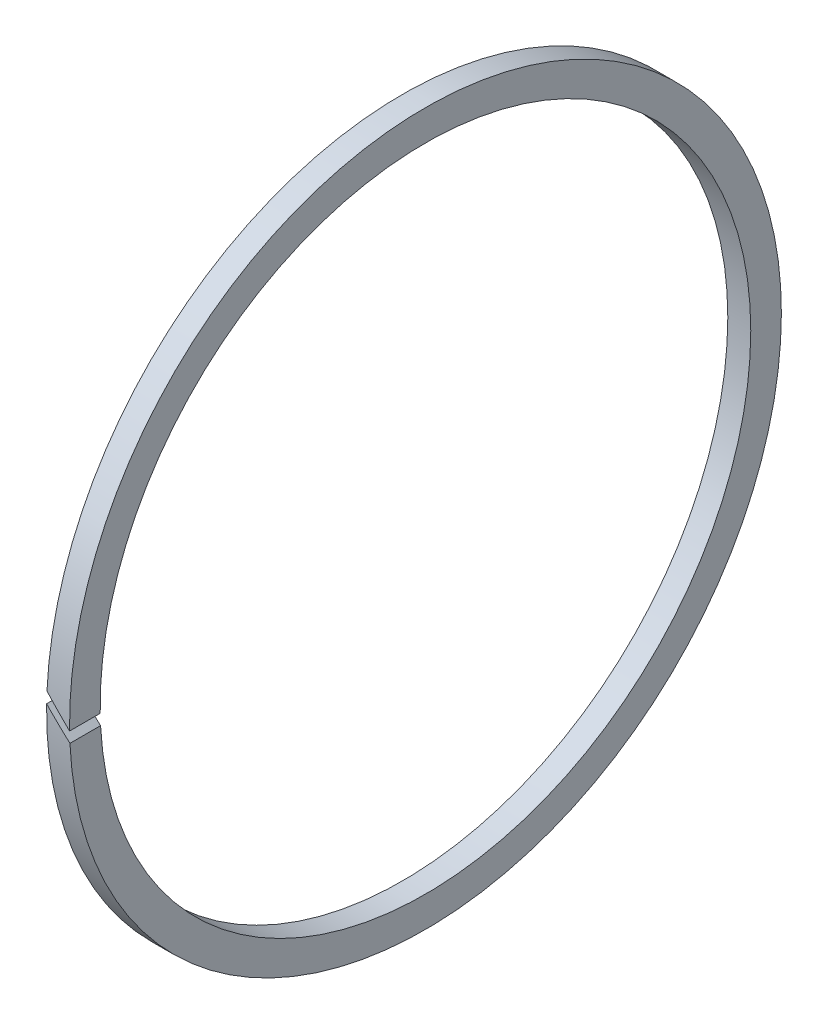
from build123d import *

# Parameters (mm, degrees)
SKETCH1_W               = 3
SKETCH1_H               = 4
CUT_EXTRUDE2_REACH      = 67.829
CUT_EXTRUDE2_END_RADIUS = 46.5


with BuildPart() as part:
    # Sketch1 → Revolve1 (revolve)
    with BuildSketch(Plane.XY, mode=Mode.PRIVATE) as revolve1_sk:
        with Locations((1.5, 44.5)):
            Rectangle(SKETCH1_W, SKETCH1_H)
    revolve(revolve1_sk.sketch.rotate(Axis((0, 0, 0), (1, 0, 0)), 90), axis=Axis((0, 0, 0), (1, 0, 0)))

    # Cut-Extrude2: up to this cylinder (the profile starts inside it)
    cut_extrude2_end = Plane(origin=(1.5, 0, 0), z_dir=(-1, 0, 0)) * Cylinder(CUT_EXTRUDE2_END_RADIUS, 229.658, mode=Mode.PRIVATE)
    # Sketch5 → Cut-Extrude2 (cut, up to the surface)
    with BuildSketch(Plane.XY, mode=Mode.PRIVATE) as cut_extrude2_sk1:
        Polygon((-1.693170975, 2.486064194), (3.986064194, -3.193170975), (4.693170975, -2.486064194), (-0.986064194, 3.193170975), align=None)
    cut_extrude2_tool1 = extrude(cut_extrude2_sk1.sketch, amount=CUT_EXTRUDE2_REACH, mode=Mode.PRIVATE) & cut_extrude2_end
    add(cut_extrude2_tool1.solids().sort_by_distance((1.5, 0, 0))[0], mode=Mode.SUBTRACT)


solid = part.part
